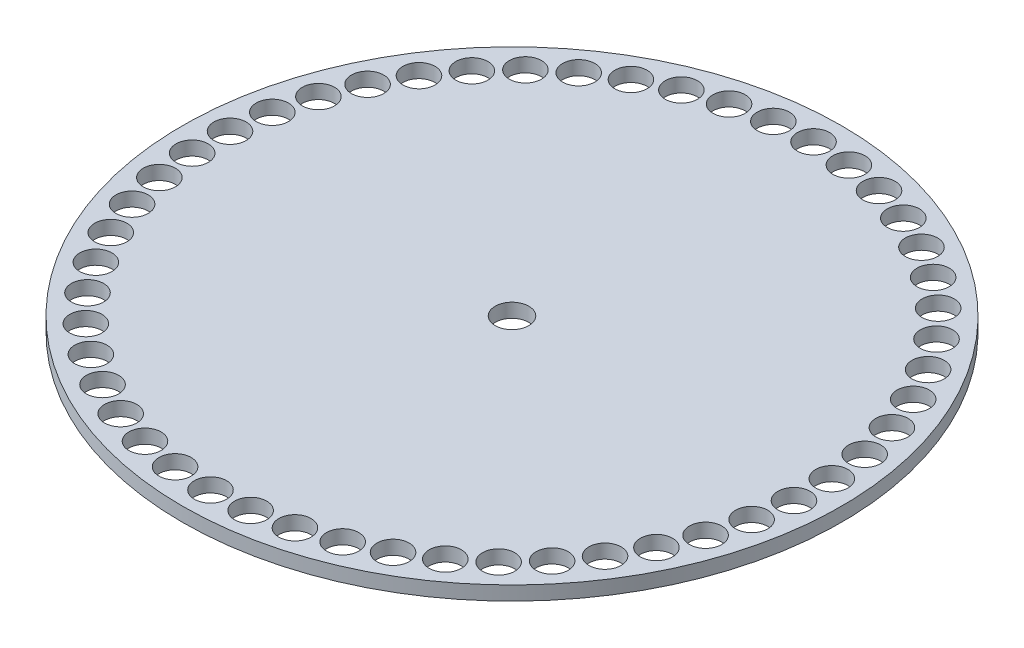
from build123d import *

# Parameters (mm, degrees)
SKETCH1_R           = 117.5
BOSS_EXTRUDE1_DEPTH = 5
SKETCH2_R           = 5.75
CUT_EXTRUDE1_DEPTH  = 167.245300685
CIRPATTERN1_COUNT   = 50
SKETCH3_R           = 6
CUT_EXTRUDE2_DEPTH  = 167.245300685


with BuildPart() as part:
    # Sketch1 → Boss-Extrude1 (new body)
    with BuildSketch(Plane(origin=(0, 0, 0), x_dir=(1, 0, 0), z_dir=(0, 1, 0))):
        with Locations(Location((0, 0, 0), (0, 0, 270))):
            Circle(SKETCH1_R)
    extrude(amount=BOSS_EXTRUDE1_DEPTH)

    # Sketch2 → Cut-Extrude1 (cut, through all)
    with BuildSketch(Plane(origin=(0, 5, 0), x_dir=(1, 0, 0), z_dir=(0, 1, 0))):
        with Locations(Location((0, 107.5, 0), (0, 0, 270))):
            Circle(SKETCH2_R)
    cut_extrude1 = extrude(amount=-CUT_EXTRUDE1_DEPTH, mode=Mode.SUBTRACT)

    # CirPattern1: Cut-Extrude1 ×50 about axis
    cirpattern1_axis = Axis((0, 0, 0), (0, 1, 0))
    for i in range(1, CIRPATTERN1_COUNT):
        add(cut_extrude1.rotate(cirpattern1_axis, i * 360 / CIRPATTERN1_COUNT), mode=Mode.SUBTRACT)

    # Sketch3 → Cut-Extrude2 (cut, through all)
    with BuildSketch(Plane(origin=(0, 5, 0), x_dir=(1, 0, 0), z_dir=(0, 1, 0))):
        with Locations(Location((0, 0, 0), (0, 0, 270))):
            Circle(SKETCH3_R)
    extrude(amount=-CUT_EXTRUDE2_DEPTH, mode=Mode.SUBTRACT)


solid = part.part
